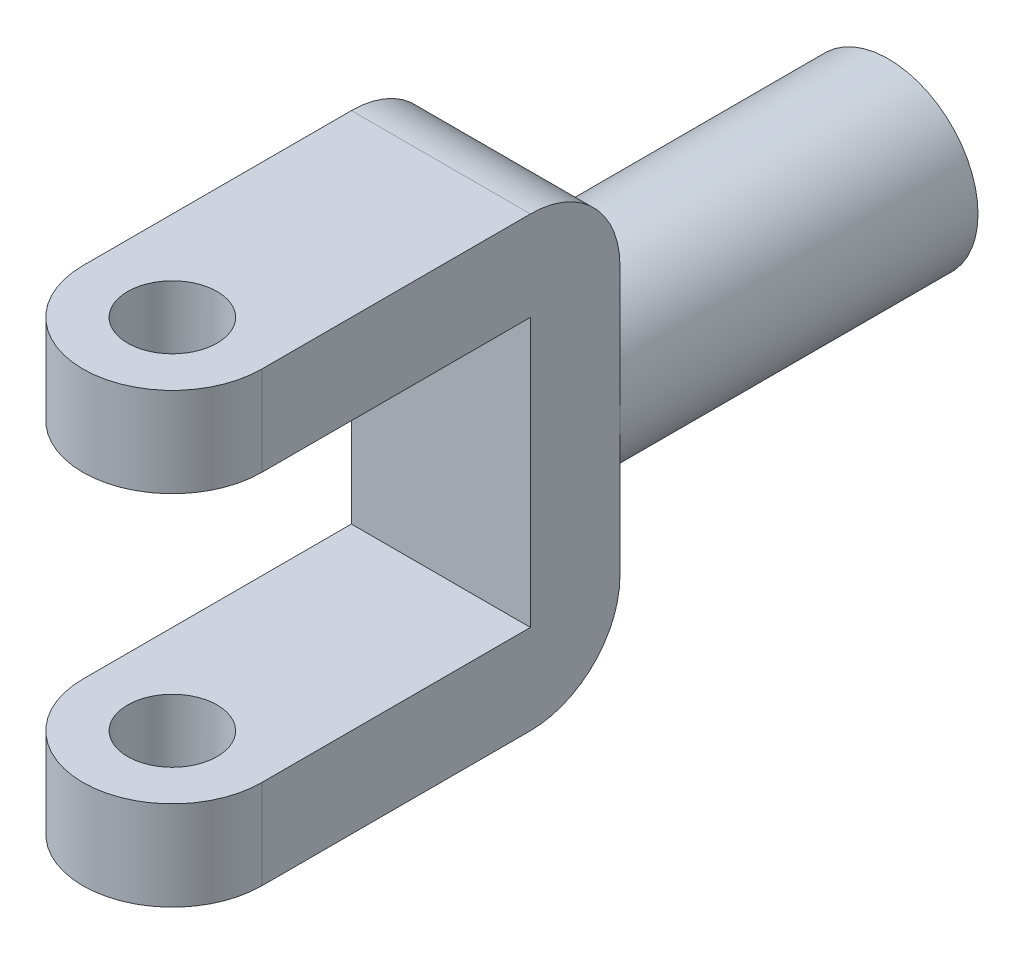
from build123d import *

# Parameters (mm, degrees)
SKETCH1_R           = 5
BOSS_EXTRUDE1_DEPTH = 20
BOSS_EXTRUDE2_DEPTH = 5
SKETCH3_W           = 10
SKETCH3_H           = 5
BOSS_EXTRUDE3_DEPTH = 20
SKETCH4_R           = 2.5
CUT_EXTRUDE1_DEPTH  = 52.720402164
FILLET1_RADIUS      = 5
FILLET1_LENGTH      = 5
FILLET2_RADIUS      = 5
FILLET2_LENGTH      = 5
FILLET4_R           = 5
FILLET5_R           = 5


with BuildPart() as part:
    # Sketch1 → Boss-Extrude1 (new body)
    with BuildSketch(Plane.XY):
        Circle(SKETCH1_R)
    extrude(amount=BOSS_EXTRUDE1_DEPTH)

    # Sketch2 → Boss-Extrude2 (add)
    with BuildSketch(Plane.XY.offset(20)):
        Polygon((-5, 0), (-5, 12.5), (5, 12.5), (5, -12.5), (-5, -12.5), align=None)
    extrude(amount=BOSS_EXTRUDE2_DEPTH)

    # Sketch3 → Boss-Extrude3 (add)
    with BuildSketch(Plane.XY.offset(25)):
        with Locations((0, 10)):
            Rectangle(SKETCH3_W, SKETCH3_H)
        with Locations((0, -10)):
            Rectangle(SKETCH3_W, SKETCH3_H)
    extrude(amount=BOSS_EXTRUDE3_DEPTH)

    # Sketch4 → Cut-Extrude1 (cut, through all)
    with BuildSketch(Plane(origin=(0, 12.5, 0), x_dir=(1, 0, 0), z_dir=(0, 1, 0))):
        with Locations(Location((0, -40, 0), (0, 0, 180))):
            Circle(SKETCH4_R)
    extrude(amount=-CUT_EXTRUDE1_DEPTH, mode=Mode.SUBTRACT)

    # Fillet1: full round fillet: the end face becomes a half cylinder, R = half its width
    fillet1_face = Plane((0, 10, 45), x_dir=(0, -1, 0), z_dir=(0, 0, 1))  # on the end face: x along it, z out of the body
    fillet1_slab = fillet1_face.offset(-FILLET1_RADIUS / 2) * Box(FILLET1_LENGTH, 2 * FILLET1_RADIUS, FILLET1_RADIUS, mode=Mode.PRIVATE)  # the body's end, R deep
    fillet1_round = Plane((0, 10, 40), x_dir=(0, 0, 1), z_dir=(0, -1, 0)) * Cylinder(FILLET1_RADIUS, FILLET1_LENGTH, mode=Mode.PRIVATE)  # its axis R under the face
    add(fillet1_slab - fillet1_round, mode=Mode.SUBTRACT)

    # Fillet2: full round fillet: the end face becomes a half cylinder, R = half its width
    fillet2_face = Plane((0, -10, 45), x_dir=(0, -1, 0), z_dir=(0, 0, 1))  # on the end face: x along it, z out of the body
    fillet2_slab = fillet2_face.offset(-FILLET2_RADIUS / 2) * Box(FILLET2_LENGTH, 2 * FILLET2_RADIUS, FILLET2_RADIUS, mode=Mode.PRIVATE)  # the body's end, R deep
    fillet2_round = Plane((0, -10, 40), x_dir=(0, 0, 1), z_dir=(0, -1, 0)) * Cylinder(FILLET2_RADIUS, FILLET2_LENGTH, mode=Mode.PRIVATE)  # its axis R under the face
    add(fillet2_slab - fillet2_round, mode=Mode.SUBTRACT)

    # Fillet4
    fillet4_edges = [part.edges().sort_by_distance(p)[0] for p in [
        (0, 12.5, 20),
    ]]
    fillet(fillet4_edges, radius=FILLET4_R)

    # Fillet5
    fillet5_edges = [part.edges().sort_by_distance(p)[0] for p in [
        (0, -12.5, 20),
    ]]
    fillet(fillet5_edges, radius=FILLET5_R)


solid = part.part
